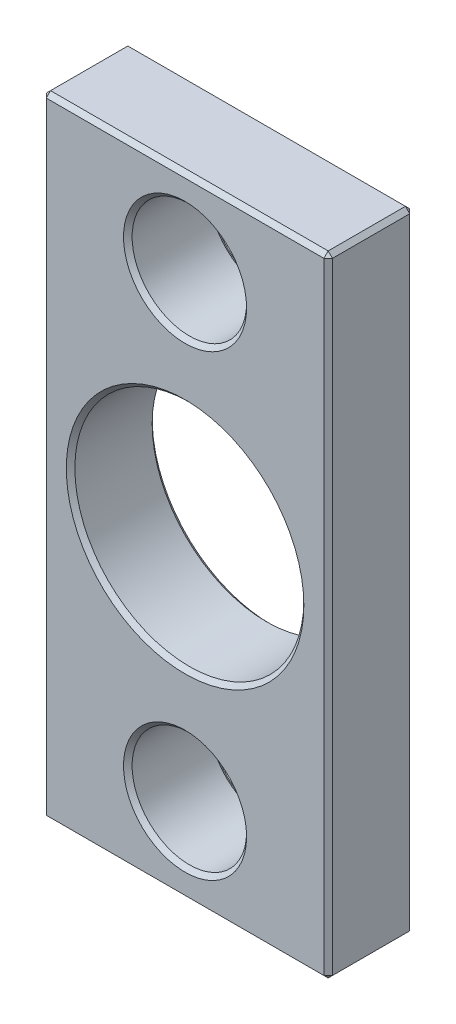
from build123d import *

# Parameters (mm, degrees)
SKETCH1_W           = 10
SKETCH1_H           = 22
SKETCH1_R           = 4
SKETCH1_R_2         = 2
BOSS_EXTRUDE1_DEPTH = 1.5
CHAMFER1_SIZE       = 0.15


with BuildPart() as part:
    # Sketch1 → Boss-Extrude1 (new, symmetric)
    with BuildSketch(Plane.XY):
        Rectangle(SKETCH1_W, SKETCH1_H)
        Circle(SKETCH1_R, mode=Mode.SUBTRACT)
        with Locations((0, -8)):
            Circle(SKETCH1_R_2, mode=Mode.SUBTRACT)
        with Locations((0, 8)):
            Circle(SKETCH1_R_2, mode=Mode.SUBTRACT)
    extrude(amount=BOSS_EXTRUDE1_DEPTH, both=True)

    # Chamfer1
    chamfer1_edges = [part.edges().sort_by_distance(p)[0] for p in [
        (-4, 0, -1.5),
        (-4, 0, 1.5),
        (5, 0, 1.5),
        (-2, -8, -1.5),
        (-2, -8, 1.5),
        (0, 11, 1.5),
        (-2, 8, -1.5),
        (-2, 8, 1.5),
        (-5, 0, 1.5),
        (0, 11, -1.5),
        (5, 0, -1.5),
        (0, -11, -1.5),
        (-5, 0, -1.5),
        (-5, 11, 0),
        (5, 11, 0),
        (5, -11, 0),
        (-5, -11, 0),
        (0, -11, 1.5),
    ]]
    chamfer(chamfer1_edges, length=CHAMFER1_SIZE)


solid = part.part
